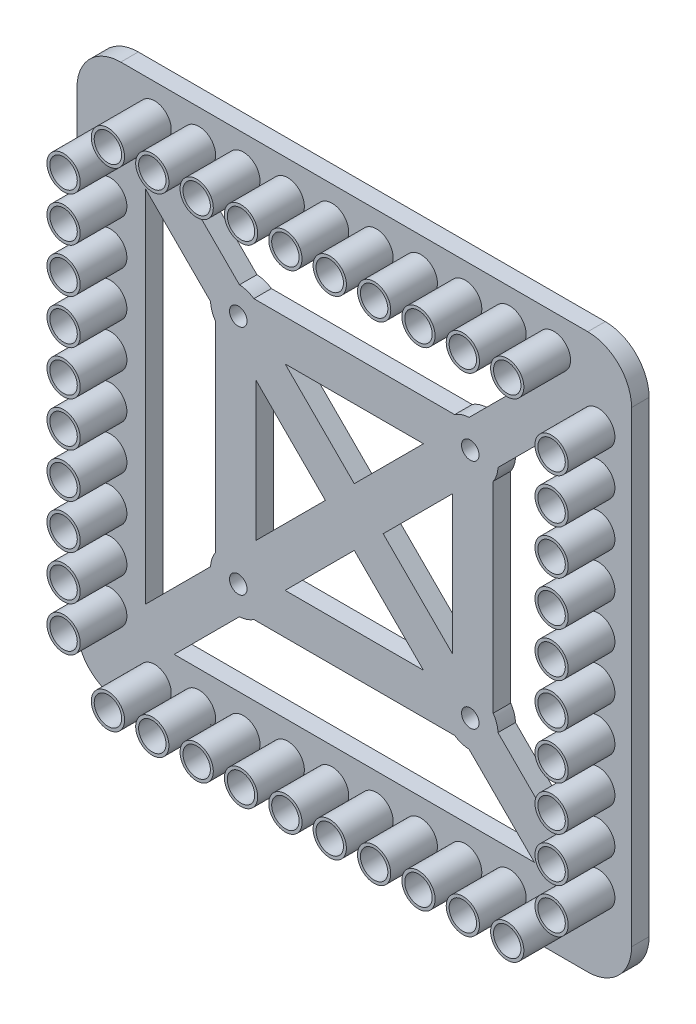
from build123d import *

# Parameters (mm, degrees)
SKETCH1_R              = 5.7
SKETCH1_R_2            = 4.7
BOSS_EXTRUDE1_DEPTH    = 16
BOSS_EXTRUDE1_2_DEPTH  = 16
BOSS_EXTRUDE1_3_DEPTH  = 16
BOSS_EXTRUDE1_4_DEPTH  = 16
BOSS_EXTRUDE1_5_DEPTH  = 16
BOSS_EXTRUDE1_6_DEPTH  = 16
BOSS_EXTRUDE1_7_DEPTH  = 16
BOSS_EXTRUDE1_8_DEPTH  = 16
BOSS_EXTRUDE1_9_DEPTH  = 16
BOSS_EXTRUDE1_10_DEPTH = 16
BOSS_EXTRUDE1_11_DEPTH = 16
BOSS_EXTRUDE1_12_DEPTH = 16
BOSS_EXTRUDE1_13_DEPTH = 16
BOSS_EXTRUDE1_14_DEPTH = 16
BOSS_EXTRUDE1_15_DEPTH = 16
BOSS_EXTRUDE1_16_DEPTH = 16
BOSS_EXTRUDE1_17_DEPTH = 16
BOSS_EXTRUDE1_18_DEPTH = 16
BOSS_EXTRUDE1_19_DEPTH = 16
BOSS_EXTRUDE1_20_DEPTH = 16
BOSS_EXTRUDE1_21_DEPTH = 16
BOSS_EXTRUDE1_22_DEPTH = 16
BOSS_EXTRUDE1_23_DEPTH = 16
BOSS_EXTRUDE1_24_DEPTH = 16
BOSS_EXTRUDE1_25_DEPTH = 16
BOSS_EXTRUDE1_26_DEPTH = 16
BOSS_EXTRUDE1_27_DEPTH = 16
BOSS_EXTRUDE1_28_DEPTH = 16
BOSS_EXTRUDE1_29_DEPTH = 16
BOSS_EXTRUDE1_30_DEPTH = 16
BOSS_EXTRUDE1_31_DEPTH = 16
BOSS_EXTRUDE1_32_DEPTH = 16
BOSS_EXTRUDE1_33_DEPTH = 16
BOSS_EXTRUDE1_34_DEPTH = 16
BOSS_EXTRUDE1_35_DEPTH = 16
BOSS_EXTRUDE1_36_DEPTH = 16
BOSS_EXTRUDE1_37_DEPTH = 16
BOSS_EXTRUDE1_38_DEPTH = 16
BOSS_EXTRUDE1_39_DEPTH = 16
BOSS_EXTRUDE1_40_DEPTH = 16
BOSS_EXTRUDE3_START    = -6
SKETCH4_W              = 190
SKETCH4_H              = 190
SKETCH4_R              = 4.7
BOSS_EXTRUDE3_DEPTH    = 6
SKETCH5_R              = 3
CUT_EXTRUDE1_DEPTH     = 6
CUT_EXTRUDE2_DEPTH     = 6
SKETCH8_R              = 9.5
SKETCH8_R_2            = 3
SKETCH8_R_3            = 3.109379702
BOSS_EXTRUDE4_DEPTH    = 6
FILLET1_R              = 15


with BuildPart() as part:
    # Sketch1 → Boss-Extrude1 (new body)
    with BuildSketch(Plane.XY):
        with Locations((453.680836538, -1249.606745703)):
            Circle(SKETCH1_R)
        with Locations((453.680836538, -1249.606745703)):
            Circle(SKETCH1_R_2, mode=Mode.SUBTRACT)
    extrude(amount=BOSS_EXTRUDE1_DEPTH)



with BuildPart() as body_2:
    # Sketch1 → Boss-Extrude1 2 (new body)
    with BuildSketch(Plane.XY):
        with Locations((468.880836538, -1249.606745703)):
            Circle(SKETCH1_R)
        with Locations((468.880836538, -1249.606745703)):
            Circle(SKETCH1_R_2, mode=Mode.SUBTRACT)
    extrude(amount=BOSS_EXTRUDE1_2_DEPTH)


with BuildPart() as body_3:
    # Sketch1 → Boss-Extrude1 3 (new body)
    with BuildSketch(Plane.XY):
        with Locations((484.080836538, -1249.606745703)):
            Circle(SKETCH1_R)
        with Locations((484.080836538, -1249.606745703)):
            Circle(SKETCH1_R_2, mode=Mode.SUBTRACT)
    extrude(amount=BOSS_EXTRUDE1_3_DEPTH)


with BuildPart() as body_4:
    # Sketch1 → Boss-Extrude1 4 (new body)
    with BuildSketch(Plane.XY):
        with Locations((499.280836538, -1249.606745703)):
            Circle(SKETCH1_R)
        with Locations((499.280836538, -1249.606745703)):
            Circle(SKETCH1_R_2, mode=Mode.SUBTRACT)
    extrude(amount=BOSS_EXTRUDE1_4_DEPTH)


with BuildPart() as body_5:
    # Sketch1 → Boss-Extrude1 5 (new body)
    with BuildSketch(Plane.XY):
        with Locations((514.480836538, -1249.606745703)):
            Circle(SKETCH1_R)
        with Locations((514.480836538, -1249.606745703)):
            Circle(SKETCH1_R_2, mode=Mode.SUBTRACT)
    extrude(amount=BOSS_EXTRUDE1_5_DEPTH)


with BuildPart() as body_6:
    # Sketch1 → Boss-Extrude1 6 (new body)
    with BuildSketch(Plane.XY):
        with Locations((529.680836538, -1249.606745703)):
            Circle(SKETCH1_R)
        with Locations((529.680836538, -1249.606745703)):
            Circle(SKETCH1_R_2, mode=Mode.SUBTRACT)
    extrude(amount=BOSS_EXTRUDE1_6_DEPTH)


with BuildPart() as body_7:
    # Sketch1 → Boss-Extrude1 7 (new body)
    with BuildSketch(Plane.XY):
        with Locations((544.880836538, -1249.606745703)):
            Circle(SKETCH1_R)
        with Locations((544.880836538, -1249.606745703)):
            Circle(SKETCH1_R_2, mode=Mode.SUBTRACT)
    extrude(amount=BOSS_EXTRUDE1_7_DEPTH)


with BuildPart() as body_8:
    # Sketch1 → Boss-Extrude1 8 (new body)
    with BuildSketch(Plane.XY):
        with Locations((560.080836538, -1249.606745703)):
            Circle(SKETCH1_R)
        with Locations((560.080836538, -1249.606745703)):
            Circle(SKETCH1_R_2, mode=Mode.SUBTRACT)
    extrude(amount=BOSS_EXTRUDE1_8_DEPTH)


with BuildPart() as body_9:
    # Sketch1 → Boss-Extrude1 9 (new body)
    with BuildSketch(Plane.XY):
        with Locations((575.280836538, -1249.606745703)):
            Circle(SKETCH1_R)
        with Locations((575.280836538, -1249.606745703)):
            Circle(SKETCH1_R_2, mode=Mode.SUBTRACT)
    extrude(amount=BOSS_EXTRUDE1_9_DEPTH)


with BuildPart() as body_10:
    # Sketch1 → Boss-Extrude1 10 (new body)
    with BuildSketch(Plane.XY):
        with Locations((590.480836538, -1249.606745703)):
            Circle(SKETCH1_R)
        with Locations((590.480836538, -1249.606745703)):
            Circle(SKETCH1_R_2, mode=Mode.SUBTRACT)
    extrude(amount=BOSS_EXTRUDE1_10_DEPTH)


with BuildPart() as body_11:
    # Sketch1 → Boss-Extrude1 11 (new body)
    with BuildSketch(Plane.XY):
        with Locations((438.480836538, -1264.806745703)):
            Circle(SKETCH1_R)
        with Locations((438.480836538, -1264.806745703)):
            Circle(SKETCH1_R_2, mode=Mode.SUBTRACT)
    extrude(amount=BOSS_EXTRUDE1_11_DEPTH)


with BuildPart() as body_12:
    # Sketch1 → Boss-Extrude1 12 (new body)
    with BuildSketch(Plane.XY):
        with Locations((438.480836538, -1280.006745703)):
            Circle(SKETCH1_R)
        with Locations((438.480836538, -1280.006745703)):
            Circle(SKETCH1_R_2, mode=Mode.SUBTRACT)
    extrude(amount=BOSS_EXTRUDE1_12_DEPTH)


with BuildPart() as body_13:
    # Sketch1 → Boss-Extrude1 13 (new body)
    with BuildSketch(Plane.XY):
        with Locations((438.480836538, -1295.206745703)):
            Circle(SKETCH1_R)
        with Locations((438.480836538, -1295.206745703)):
            Circle(SKETCH1_R_2, mode=Mode.SUBTRACT)
    extrude(amount=BOSS_EXTRUDE1_13_DEPTH)


with BuildPart() as body_14:
    # Sketch1 → Boss-Extrude1 14 (new body)
    with BuildSketch(Plane.XY):
        with Locations((438.480836538, -1310.406745703)):
            Circle(SKETCH1_R)
        with Locations((438.480836538, -1310.406745703)):
            Circle(SKETCH1_R_2, mode=Mode.SUBTRACT)
    extrude(amount=BOSS_EXTRUDE1_14_DEPTH)


with BuildPart() as body_15:
    # Sketch1 → Boss-Extrude1 15 (new body)
    with BuildSketch(Plane.XY):
        with Locations((438.480836538, -1325.606745703)):
            Circle(SKETCH1_R)
        with Locations((438.480836538, -1325.606745703)):
            Circle(SKETCH1_R_2, mode=Mode.SUBTRACT)
    extrude(amount=BOSS_EXTRUDE1_15_DEPTH)


with BuildPart() as body_16:
    # Sketch1 → Boss-Extrude1 16 (new body)
    with BuildSketch(Plane.XY):
        with Locations((438.480836538, -1340.806745703)):
            Circle(SKETCH1_R)
        with Locations((438.480836538, -1340.806745703)):
            Circle(SKETCH1_R_2, mode=Mode.SUBTRACT)
    extrude(amount=BOSS_EXTRUDE1_16_DEPTH)


with BuildPart() as body_17:
    # Sketch1 → Boss-Extrude1 17 (new body)
    with BuildSketch(Plane.XY):
        with Locations((438.480836538, -1356.006745703)):
            Circle(SKETCH1_R)
        with Locations((438.480836538, -1356.006745703)):
            Circle(SKETCH1_R_2, mode=Mode.SUBTRACT)
    extrude(amount=BOSS_EXTRUDE1_17_DEPTH)


with BuildPart() as body_18:
    # Sketch1 → Boss-Extrude1 18 (new body)
    with BuildSketch(Plane.XY):
        with Locations((438.480836538, -1371.206745703)):
            Circle(SKETCH1_R)
        with Locations((438.480836538, -1371.206745703)):
            Circle(SKETCH1_R_2, mode=Mode.SUBTRACT)
    extrude(amount=BOSS_EXTRUDE1_18_DEPTH)


with BuildPart() as body_19:
    # Sketch1 → Boss-Extrude1 19 (new body)
    with BuildSketch(Plane.XY):
        with Locations((438.480836538, -1386.406745703)):
            Circle(SKETCH1_R)
        with Locations((438.480836538, -1386.406745703)):
            Circle(SKETCH1_R_2, mode=Mode.SUBTRACT)
    extrude(amount=BOSS_EXTRUDE1_19_DEPTH)


with BuildPart() as body_20:
    # Sketch1 → Boss-Extrude1 20 (new body)
    with BuildSketch(Plane.XY):
        with Locations((438.480836538, -1401.606745703)):
            Circle(SKETCH1_R)
        with Locations((438.480836538, -1401.606745703)):
            Circle(SKETCH1_R_2, mode=Mode.SUBTRACT)
    extrude(amount=BOSS_EXTRUDE1_20_DEPTH)


with BuildPart() as body_21:
    # Sketch1 → Boss-Extrude1 21 (new body)
    with BuildSketch(Plane.XY):
        with Locations(Location((453.680836538, -1416.806745703, 0), (0, 0, 180))):
            Circle(SKETCH1_R)
        with Locations(Location((453.680836538, -1416.806745703, 0), (0, 0, 180))):
            Circle(SKETCH1_R_2, mode=Mode.SUBTRACT)
    extrude(amount=BOSS_EXTRUDE1_21_DEPTH)


with BuildPart() as body_22:
    # Sketch1 → Boss-Extrude1 22 (new body)
    with BuildSketch(Plane.XY):
        with Locations(Location((468.880836538, -1416.806745703, 0), (0, 0, 180))):
            Circle(SKETCH1_R)
        with Locations(Location((468.880836538, -1416.806745703, 0), (0, 0, 180))):
            Circle(SKETCH1_R_2, mode=Mode.SUBTRACT)
    extrude(amount=BOSS_EXTRUDE1_22_DEPTH)


with BuildPart() as body_23:
    # Sketch1 → Boss-Extrude1 23 (new body)
    with BuildSketch(Plane.XY):
        with Locations(Location((484.080836538, -1416.806745703, 0), (0, 0, 180))):
            Circle(SKETCH1_R)
        with Locations(Location((484.080836538, -1416.806745703, 0), (0, 0, 180))):
            Circle(SKETCH1_R_2, mode=Mode.SUBTRACT)
    extrude(amount=BOSS_EXTRUDE1_23_DEPTH)


with BuildPart() as body_24:
    # Sketch1 → Boss-Extrude1 24 (new body)
    with BuildSketch(Plane.XY):
        with Locations(Location((499.280836538, -1416.806745703, 0), (0, 0, 180))):
            Circle(SKETCH1_R)
        with Locations(Location((499.280836538, -1416.806745703, 0), (0, 0, 180))):
            Circle(SKETCH1_R_2, mode=Mode.SUBTRACT)
    extrude(amount=BOSS_EXTRUDE1_24_DEPTH)


with BuildPart() as body_25:
    # Sketch1 → Boss-Extrude1 25 (new body)
    with BuildSketch(Plane.XY):
        with Locations(Location((514.480836538, -1416.806745703, 0), (0, 0, 180))):
            Circle(SKETCH1_R)
        with Locations(Location((514.480836538, -1416.806745703, 0), (0, 0, 180))):
            Circle(SKETCH1_R_2, mode=Mode.SUBTRACT)
    extrude(amount=BOSS_EXTRUDE1_25_DEPTH)


with BuildPart() as body_26:
    # Sketch1 → Boss-Extrude1 26 (new body)
    with BuildSketch(Plane.XY):
        with Locations(Location((529.680836538, -1416.806745703, 0), (0, 0, 180))):
            Circle(SKETCH1_R)
        with Locations(Location((529.680836538, -1416.806745703, 0), (0, 0, 180))):
            Circle(SKETCH1_R_2, mode=Mode.SUBTRACT)
    extrude(amount=BOSS_EXTRUDE1_26_DEPTH)


with BuildPart() as body_27:
    # Sketch1 → Boss-Extrude1 27 (new body)
    with BuildSketch(Plane.XY):
        with Locations(Location((544.880836538, -1416.806745703, 0), (0, 0, 180))):
            Circle(SKETCH1_R)
        with Locations(Location((544.880836538, -1416.806745703, 0), (0, 0, 180))):
            Circle(SKETCH1_R_2, mode=Mode.SUBTRACT)
    extrude(amount=BOSS_EXTRUDE1_27_DEPTH)


with BuildPart() as body_28:
    # Sketch1 → Boss-Extrude1 28 (new body)
    with BuildSketch(Plane.XY):
        with Locations(Location((560.080836538, -1416.806745703, 0), (0, 0, 180))):
            Circle(SKETCH1_R)
        with Locations(Location((560.080836538, -1416.806745703, 0), (0, 0, 180))):
            Circle(SKETCH1_R_2, mode=Mode.SUBTRACT)
    extrude(amount=BOSS_EXTRUDE1_28_DEPTH)


with BuildPart() as body_29:
    # Sketch1 → Boss-Extrude1 29 (new body)
    with BuildSketch(Plane.XY):
        with Locations(Location((575.280836538, -1416.806745703, 0), (0, 0, 180))):
            Circle(SKETCH1_R)
        with Locations(Location((575.280836538, -1416.806745703, 0), (0, 0, 180))):
            Circle(SKETCH1_R_2, mode=Mode.SUBTRACT)
    extrude(amount=BOSS_EXTRUDE1_29_DEPTH)


with BuildPart() as body_30:
    # Sketch1 → Boss-Extrude1 30 (new body)
    with BuildSketch(Plane.XY):
        with Locations(Location((590.480836538, -1416.806745703, 0), (0, 0, 180))):
            Circle(SKETCH1_R)
        with Locations(Location((590.480836538, -1416.806745703, 0), (0, 0, 180))):
            Circle(SKETCH1_R_2, mode=Mode.SUBTRACT)
    extrude(amount=BOSS_EXTRUDE1_30_DEPTH)


with BuildPart() as body_31:
    # Sketch1 → Boss-Extrude1 31 (new body)
    with BuildSketch(Plane.XY):
        with Locations(Location((605.680836538, -1264.806745703, 0), (0, 0, 180))):
            Circle(SKETCH1_R)
        with Locations(Location((605.680836538, -1264.806745703, 0), (0, 0, 180))):
            Circle(SKETCH1_R_2, mode=Mode.SUBTRACT)
    extrude(amount=BOSS_EXTRUDE1_31_DEPTH)


with BuildPart() as body_32:
    # Sketch1 → Boss-Extrude1 32 (new body)
    with BuildSketch(Plane.XY):
        with Locations(Location((605.680836538, -1280.006745703, 0), (0, 0, 180))):
            Circle(SKETCH1_R)
        with Locations(Location((605.680836538, -1280.006745703, 0), (0, 0, 180))):
            Circle(SKETCH1_R_2, mode=Mode.SUBTRACT)
    extrude(amount=BOSS_EXTRUDE1_32_DEPTH)


with BuildPart() as body_33:
    # Sketch1 → Boss-Extrude1 33 (new body)
    with BuildSketch(Plane.XY):
        with Locations(Location((605.680836538, -1295.206745703, 0), (0, 0, 180))):
            Circle(SKETCH1_R)
        with Locations(Location((605.680836538, -1295.206745703, 0), (0, 0, 180))):
            Circle(SKETCH1_R_2, mode=Mode.SUBTRACT)
    extrude(amount=BOSS_EXTRUDE1_33_DEPTH)


with BuildPart() as body_34:
    # Sketch1 → Boss-Extrude1 34 (new body)
    with BuildSketch(Plane.XY):
        with Locations(Location((605.680836538, -1310.406745703, 0), (0, 0, 180))):
            Circle(SKETCH1_R)
        with Locations(Location((605.680836538, -1310.406745703, 0), (0, 0, 180))):
            Circle(SKETCH1_R_2, mode=Mode.SUBTRACT)
    extrude(amount=BOSS_EXTRUDE1_34_DEPTH)


with BuildPart() as body_35:
    # Sketch1 → Boss-Extrude1 35 (new body)
    with BuildSketch(Plane.XY):
        with Locations(Location((605.680836538, -1325.606745703, 0), (0, 0, 180))):
            Circle(SKETCH1_R)
        with Locations(Location((605.680836538, -1325.606745703, 0), (0, 0, 180))):
            Circle(SKETCH1_R_2, mode=Mode.SUBTRACT)
    extrude(amount=BOSS_EXTRUDE1_35_DEPTH)


with BuildPart() as body_36:
    # Sketch1 → Boss-Extrude1 36 (new body)
    with BuildSketch(Plane.XY):
        with Locations(Location((605.680836538, -1340.806745703, 0), (0, 0, 180))):
            Circle(SKETCH1_R)
        with Locations(Location((605.680836538, -1340.806745703, 0), (0, 0, 180))):
            Circle(SKETCH1_R_2, mode=Mode.SUBTRACT)
    extrude(amount=BOSS_EXTRUDE1_36_DEPTH)


with BuildPart() as body_37:
    # Sketch1 → Boss-Extrude1 37 (new body)
    with BuildSketch(Plane.XY):
        with Locations(Location((605.680836538, -1356.006745703, 0), (0, 0, 180))):
            Circle(SKETCH1_R)
        with Locations(Location((605.680836538, -1356.006745703, 0), (0, 0, 180))):
            Circle(SKETCH1_R_2, mode=Mode.SUBTRACT)
    extrude(amount=BOSS_EXTRUDE1_37_DEPTH)


with BuildPart() as body_38:
    # Sketch1 → Boss-Extrude1 38 (new body)
    with BuildSketch(Plane.XY):
        with Locations(Location((605.680836538, -1371.206745703, 0), (0, 0, 180))):
            Circle(SKETCH1_R)
        with Locations(Location((605.680836538, -1371.206745703, 0), (0, 0, 180))):
            Circle(SKETCH1_R_2, mode=Mode.SUBTRACT)
    extrude(amount=BOSS_EXTRUDE1_38_DEPTH)


with BuildPart() as body_39:
    # Sketch1 → Boss-Extrude1 39 (new body)
    with BuildSketch(Plane.XY):
        with Locations(Location((605.680836538, -1386.406745703, 0), (0, 0, 180))):
            Circle(SKETCH1_R)
        with Locations(Location((605.680836538, -1386.406745703, 0), (0, 0, 180))):
            Circle(SKETCH1_R_2, mode=Mode.SUBTRACT)
    extrude(amount=BOSS_EXTRUDE1_39_DEPTH)


with BuildPart() as body_40:
    # Sketch1 → Boss-Extrude1 40 (new body)
    with BuildSketch(Plane.XY):
        with Locations(Location((605.680836538, -1401.606745703, 0), (0, 0, 180))):
            Circle(SKETCH1_R)
        with Locations(Location((605.680836538, -1401.606745703, 0), (0, 0, 180))):
            Circle(SKETCH1_R_2, mode=Mode.SUBTRACT)
    extrude(amount=BOSS_EXTRUDE1_40_DEPTH)


with BuildPart() as part_1:
    add(part.part)

    add(body_2.part)  # Boss-Extrude3 merges body 2

    add(body_3.part)  # Boss-Extrude3 merges body 3

    add(body_4.part)  # Boss-Extrude3 merges body 4

    add(body_5.part)  # Boss-Extrude3 merges body 5

    add(body_6.part)  # Boss-Extrude3 merges body 6

    add(body_7.part)  # Boss-Extrude3 merges body 7

    add(body_8.part)  # Boss-Extrude3 merges body 8

    add(body_9.part)  # Boss-Extrude3 merges body 9

    add(body_10.part)  # Boss-Extrude3 merges body 10

    add(body_11.part)  # Boss-Extrude3 merges body 11

    add(body_12.part)  # Boss-Extrude3 merges body 12

    add(body_13.part)  # Boss-Extrude3 merges body 13

    add(body_14.part)  # Boss-Extrude3 merges body 14

    add(body_15.part)  # Boss-Extrude3 merges body 15

    add(body_16.part)  # Boss-Extrude3 merges body 16

    add(body_17.part)  # Boss-Extrude3 merges body 17

    add(body_18.part)  # Boss-Extrude3 merges body 18

    add(body_19.part)  # Boss-Extrude3 merges body 19

    add(body_20.part)  # Boss-Extrude3 merges body 20

    add(body_21.part)  # Boss-Extrude3 merges body 21

    add(body_22.part)  # Boss-Extrude3 merges body 22

    add(body_23.part)  # Boss-Extrude3 merges body 23

    add(body_24.part)  # Boss-Extrude3 merges body 24

    add(body_25.part)  # Boss-Extrude3 merges body 25

    add(body_26.part)  # Boss-Extrude3 merges body 26

    add(body_27.part)  # Boss-Extrude3 merges body 27

    add(body_28.part)  # Boss-Extrude3 merges body 28

    add(body_29.part)  # Boss-Extrude3 merges body 29

    add(body_30.part)  # Boss-Extrude3 merges body 30

    add(body_31.part)  # Boss-Extrude3 merges body 31

    add(body_32.part)  # Boss-Extrude3 merges body 32

    add(body_33.part)  # Boss-Extrude3 merges body 33

    add(body_34.part)  # Boss-Extrude3 merges body 34

    add(body_35.part)  # Boss-Extrude3 merges body 35

    add(body_36.part)  # Boss-Extrude3 merges body 36

    add(body_37.part)  # Boss-Extrude3 merges body 37

    add(body_38.part)  # Boss-Extrude3 merges body 38

    add(body_39.part)  # Boss-Extrude3 merges body 39

    add(body_40.part)  # Boss-Extrude3 merges body 40
    # Sketch4 → Boss-Extrude3 (add)
    with BuildSketch(Plane.XY.offset(BOSS_EXTRUDE3_START)):
        with Locations((522.080836538, -1333.206745703)):
            Rectangle(SKETCH4_W, SKETCH4_H)
        with Locations((438.480836538, -1264.806745703)):
            Circle(SKETCH4_R, mode=Mode.SUBTRACT)
        with Locations((438.480836538, -1280.006745703)):
            Circle(SKETCH4_R, mode=Mode.SUBTRACT)
        with Locations((438.480836538, -1295.206745703)):
            Circle(SKETCH4_R, mode=Mode.SUBTRACT)
        with Locations((438.480836538, -1310.406745703)):
            Circle(SKETCH4_R, mode=Mode.SUBTRACT)
        with Locations((438.480836538, -1325.606745703)):
            Circle(SKETCH4_R, mode=Mode.SUBTRACT)
        with Locations((438.480836538, -1340.806745703)):
            Circle(SKETCH4_R, mode=Mode.SUBTRACT)
        with Locations((438.480836538, -1356.006745703)):
            Circle(SKETCH4_R, mode=Mode.SUBTRACT)
        with Locations((438.480836538, -1371.206745703)):
            Circle(SKETCH4_R, mode=Mode.SUBTRACT)
        with Locations((438.480836538, -1386.406745703)):
            Circle(SKETCH4_R, mode=Mode.SUBTRACT)
        with Locations((438.480836538, -1401.606745703)):
            Circle(SKETCH4_R, mode=Mode.SUBTRACT)
        with Locations((453.680836538, -1416.806745703)):
            Circle(SKETCH4_R, mode=Mode.SUBTRACT)
        with Locations((468.880836538, -1416.806745703)):
            Circle(SKETCH4_R, mode=Mode.SUBTRACT)
        with Locations((484.080836538, -1416.806745703)):
            Circle(SKETCH4_R, mode=Mode.SUBTRACT)
        with Locations((499.280836538, -1416.806745703)):
            Circle(SKETCH4_R, mode=Mode.SUBTRACT)
        with Locations((514.480836538, -1416.806745703)):
            Circle(SKETCH4_R, mode=Mode.SUBTRACT)
        with Locations((529.680836538, -1416.806745703)):
            Circle(SKETCH4_R, mode=Mode.SUBTRACT)
        with Locations((544.880836538, -1416.806745703)):
            Circle(SKETCH4_R, mode=Mode.SUBTRACT)
        with Locations((560.080836538, -1416.806745703)):
            Circle(SKETCH4_R, mode=Mode.SUBTRACT)
        with Locations((575.280836538, -1416.806745703)):
            Circle(SKETCH4_R, mode=Mode.SUBTRACT)
        with Locations((590.480836538, -1416.806745703)):
            Circle(SKETCH4_R, mode=Mode.SUBTRACT)
        with Locations((605.680836538, -1401.606745703)):
            Circle(SKETCH4_R, mode=Mode.SUBTRACT)
        with Locations((605.680836538, -1386.406745703)):
            Circle(SKETCH4_R, mode=Mode.SUBTRACT)
        with Locations((605.680836538, -1371.206745703)):
            Circle(SKETCH4_R, mode=Mode.SUBTRACT)
        with Locations((605.680836538, -1356.006745703)):
            Circle(SKETCH4_R, mode=Mode.SUBTRACT)
        with Locations((605.680836538, -1340.806745703)):
            Circle(SKETCH4_R, mode=Mode.SUBTRACT)
        with Locations((605.680836538, -1325.606745703)):
            Circle(SKETCH4_R, mode=Mode.SUBTRACT)
        with Locations((605.680836538, -1310.406745703)):
            Circle(SKETCH4_R, mode=Mode.SUBTRACT)
        with Locations((605.680836538, -1295.206745703)):
            Circle(SKETCH4_R, mode=Mode.SUBTRACT)
        with Locations((605.680836538, -1280.006745703)):
            Circle(SKETCH4_R, mode=Mode.SUBTRACT)
        with Locations((605.680836538, -1264.806745703)):
            Circle(SKETCH4_R, mode=Mode.SUBTRACT)
        with Locations((590.480836538, -1249.606745703)):
            Circle(SKETCH4_R, mode=Mode.SUBTRACT)
        with Locations((575.280836538, -1249.606745703)):
            Circle(SKETCH4_R, mode=Mode.SUBTRACT)
        with Locations((560.080836538, -1249.606745703)):
            Circle(SKETCH4_R, mode=Mode.SUBTRACT)
        with Locations((544.880836538, -1249.606745703)):
            Circle(SKETCH4_R, mode=Mode.SUBTRACT)
        with Locations((529.680836538, -1249.606745703)):
            Circle(SKETCH4_R, mode=Mode.SUBTRACT)
        with Locations((514.480836538, -1249.606745703)):
            Circle(SKETCH4_R, mode=Mode.SUBTRACT)
        with Locations((499.280836538, -1249.606745703)):
            Circle(SKETCH4_R, mode=Mode.SUBTRACT)
        with Locations((484.080836538, -1249.606745703)):
            Circle(SKETCH4_R, mode=Mode.SUBTRACT)
        with Locations((468.880836538, -1249.606745703)):
            Circle(SKETCH4_R, mode=Mode.SUBTRACT)
        with Locations((453.680836538, -1249.606745703)):
            Circle(SKETCH4_R, mode=Mode.SUBTRACT)
    extrude(amount=BOSS_EXTRUDE3_DEPTH)

    # Sketch5 → Cut-Extrude1 (cut)
    with BuildSketch(Plane.XY):
        with Locations((482.330836538, -1293.456745703)):
            Circle(SKETCH5_R)
        with Locations((561.830836538, -1293.456745703)):
            Circle(SKETCH5_R)
        with Locations((561.830836538, -1372.956745703)):
            Circle(SKETCH5_R)
        with Locations((482.330836538, -1372.956745703)):
            Circle(SKETCH5_R)
    extrude(amount=-CUT_EXTRUDE1_DEPTH, mode=Mode.SUBTRACT)

    # Sketch7 → Cut-Extrude2 (cut)
    with BuildSketch(Plane(origin=(0, 0, -6), x_dir=(-1, 0, 0), z_dir=(0, 0, -1))):
        Polygon((-460.380331474, -1261.606745703), (-583.781341601, -1261.606745703), (-559.781341601, -1285.606745703), (-484.380331474, -1285.606745703), align=None)
        Polygon((-545.781341601, -1299.606745703), (-522.080836538, -1323.307250767), (-498.380331474, -1299.606745703), align=None)
        Polygon((-555.680836538, -1356.907250767), (-531.980331474, -1333.206745703), (-555.680836538, -1309.50624064), align=None)
        Polygon((-522.080836538, -1343.10624064), (-545.781341601, -1366.806745703), (-498.380331474, -1366.806745703), align=None)
        Polygon((-488.480836538, -1309.50624064), (-512.181341601, -1333.206745703), (-488.480836538, -1356.907250767), align=None)
        Polygon((-474.480836538, -1370.907250767), (-450.480836538, -1394.907250767), (-450.480836538, -1271.50624064), (-474.480836538, -1295.50624064), align=None)
        Polygon((-559.781341601, -1380.806745703), (-583.781341601, -1404.806745703), (-460.380331474, -1404.806745703), (-484.380331474, -1380.806745703), align=None)
        Polygon((-593.680836538, -1271.50624064), (-593.680836538, -1394.907250767), (-569.680836538, -1370.907250767), (-569.680836538, -1295.50624064), align=None)
    extrude(amount=-CUT_EXTRUDE2_DEPTH, mode=Mode.SUBTRACT)

    # Sketch8 → Boss-Extrude4 (add)
    # profile 1 of 4: a face of its own
    with BuildSketch(Plane.XY):
        with Locations((482.330836538, -1372.956745703)):
            Circle(SKETCH8_R)
        with Locations((482.330836538, -1372.956745703)):
            Circle(SKETCH8_R_2, mode=Mode.SUBTRACT)
    # profile 2 of 4: a face of its own
    with BuildSketch(Plane.XY):
        with Locations((561.830836538, -1372.956745703)):
            Circle(SKETCH8_R)
        with Locations((561.830836538, -1372.956745703)):
            Circle(SKETCH8_R_2, mode=Mode.SUBTRACT)
    # profile 3 of 4: a face of its own
    with BuildSketch(Plane.XY):
        with Locations((561.830836538, -1293.456745703)):
            Circle(SKETCH8_R)
        with Locations((561.830836538, -1293.456745703)):
            Circle(SKETCH8_R_3, mode=Mode.SUBTRACT)
    # profile 4 of 4: a face of its own
    with BuildSketch(Plane.XY):
        with Locations((482.330836538, -1293.456745703)):
            Circle(SKETCH8_R)
        with Locations((482.330836538, -1293.456745703)):
            Circle(SKETCH8_R_2, mode=Mode.SUBTRACT)
    extrude(amount=-BOSS_EXTRUDE4_DEPTH)

    # Fillet1
    fillet1_edges = [part_1.edges().sort_by_distance(p)[0] for p in [
        (617.080836538, -1238.206745703, -3),
        (617.080836538, -1428.206745703, -3),
        (427.080836538, -1428.206745703, -3),
        (427.080836538, -1238.206745703, -3),
    ]]
    fillet(fillet1_edges, radius=FILLET1_R)


solid = part_1.part
